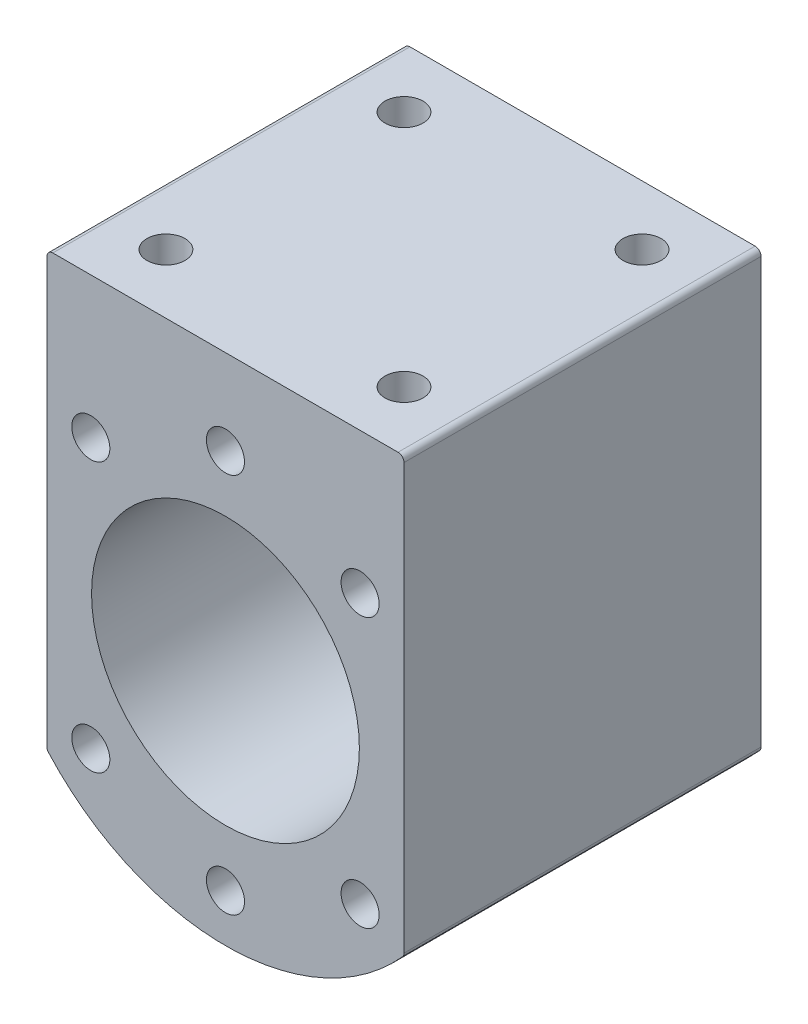
from build123d import *

# Parameters (mm, degrees)
BOSS_EXTRUDE1_DEPTH = 30
CUT_EXTRUDE2_START  = -20
SKETCH4_R           = 1.6
CUT_EXTRUDE2_DEPTH  = 20
SKETCH2_R           = 11.25
CUT_EXTRUDE3_DEPTH  = 30
SKETCH5_R           = 1.6
CUT_EXTRUDE4_DEPTH  = 9
FILLET1_R           = 0.5


with BuildPart() as part:
    # Sketch1 → Boss-Extrude1 (new body)
    with BuildSketch(Plane.XY):
        with BuildLine():
            Line((-15, 23.151243445), (-15, -13.228756555))
            ThreePointArc((-15, -13.228756555), (0, -20), (15, -13.228756555))
            Line((15, -13.228756555), (15, 23.151243445))
            Line((15, 23.151243445), (-15, 23.151243445))
        make_face()
    extrude(amount=BOSS_EXTRUDE1_DEPTH)

    # Sketch4 → Cut-Extrude2 (cut)
    with BuildSketch(Plane(origin=(0, 0, 0), x_dir=(-1, 0, 0), z_dir=(0, 0, -1)).offset(CUT_EXTRUDE2_START)):
        with Locations((-11.313708499, 11.313708499)):
            Circle(SKETCH4_R)
        with Locations((0, 16)):
            Circle(SKETCH4_R)
        with Locations((11.313708499, 11.313708499)):
            Circle(SKETCH4_R)
    cut_extrude2 = extrude(amount=-CUT_EXTRUDE2_DEPTH, mode=Mode.SUBTRACT)

    # Mirror1: Cut-Extrude2 across plane
    add(cut_extrude2.mirror(Plane.ZX), mode=Mode.SUBTRACT)

    # Sketch2 → Cut-Extrude3 (cut)
    with BuildSketch(Plane(origin=(0, 0, 0), x_dir=(-1, 0, 0), z_dir=(0, 0, -1))):
        Circle(SKETCH2_R)
    extrude(amount=-CUT_EXTRUDE3_DEPTH, mode=Mode.SUBTRACT)

    # Sketch5 → Cut-Extrude4 (cut)
    with BuildSketch(Plane(origin=(0, 23.151243445, 0), x_dir=(1, 0, 0), z_dir=(0, 1, 0))):
        with Locations(Location((10, -25, 0), (0, 0, 90))):
            Circle(SKETCH5_R)
        with Locations(Location((-10, -25, 0), (0, 0, 270))):
            Circle(SKETCH5_R)
        with Locations(Location((10, -5, 0), (0, 0, 270))):
            Circle(SKETCH5_R)
        with Locations(Location((-10, -5, 0), (0, 0, 90))):
            Circle(SKETCH5_R)
    extrude(amount=-CUT_EXTRUDE4_DEPTH, mode=Mode.SUBTRACT)

    # Fillet1
    fillet1_edges = [part.edges().sort_by_distance(p)[0] for p in [
        (15, 23.151243445, 15),
        (15, -13.228756555, 15),
        (-15, -13.228756555, 15),
        (-15, 23.151243445, 15),
    ]]
    fillet(fillet1_edges, radius=FILLET1_R)


solid = part.part
